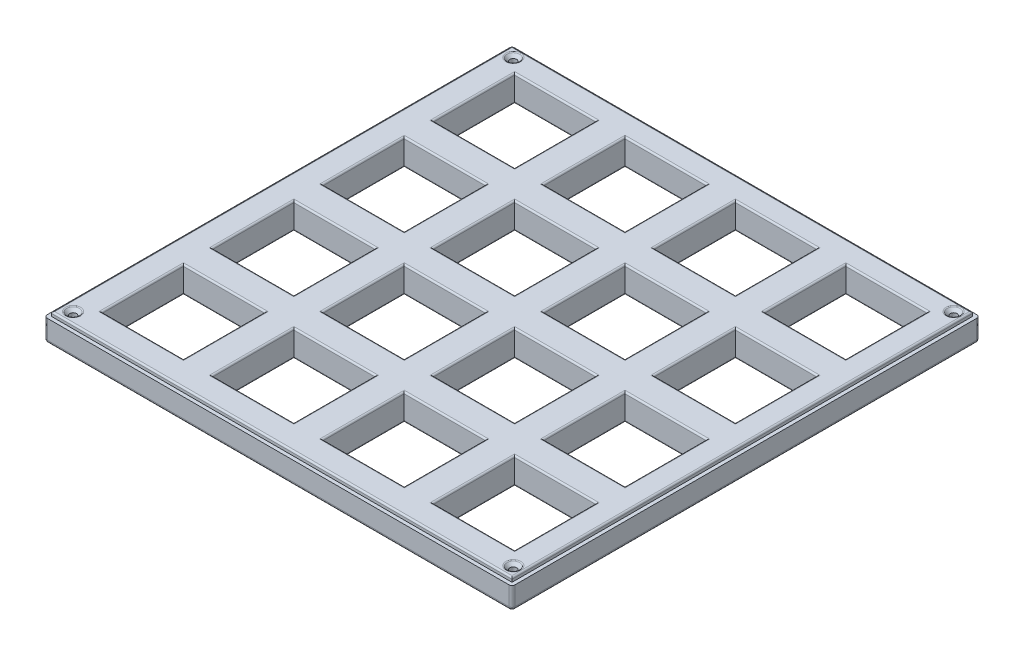
from build123d import *

# Parameters (mm, degrees)
SKETCH1_W           = 178
SKETCH1_H           = 178
BOSS_EXTRUDE1_DEPTH = 10
SKETCH2_W           = 31
SKETCH2_H           = 31
CUT_EXTRUDE1_DEPTH  = 10
SKETCH3_W           = 178
SKETCH3_H           = 178
SKETCH3_W_2         = 175.2
SKETCH3_H_2         = 175.2
CUT_EXTRUDE2_DEPTH  = 1.6
SKETCH4_R           = 1.3
CUT_EXTRUDE3_DEPTH  = 8
CHAMFER1_SIZE       = 1.3
FILLET1_R           = 0.6
FILLET2_R           = 1.2
FILLET3_R           = 0.6


with BuildPart() as part:
    # Sketch1 → Boss-Extrude1 (new body)
    with BuildSketch(Plane(origin=(0, 0, 0), x_dir=(1, 0, 0), z_dir=(0, 1, 0))):
        Rectangle(SKETCH1_W, SKETCH1_H)
    extrude(amount=BOSS_EXTRUDE1_DEPTH)

    # Sketch2 → Cut-Extrude1 (cut)
    with BuildSketch(Plane(origin=(0, 10, 0), x_dir=(1, 0, 0), z_dir=(0, 1, 0))):
        with Locations((21.5, 63.5)):
            Rectangle(SKETCH2_W, SKETCH2_H)
        with Locations((63.5, 63.5)):
            Rectangle(SKETCH2_W, SKETCH2_H)
        with Locations((-20.5, 63.5)):
            Rectangle(SKETCH2_W, SKETCH2_H)
        with Locations((-62.5, 63.5)):
            Rectangle(SKETCH2_W, SKETCH2_H)
        with Locations((21.5, 21.5)):
            Rectangle(SKETCH2_W, SKETCH2_H)
        with Locations((-20.5, 21.5)):
            Rectangle(SKETCH2_W, SKETCH2_H)
        with Locations((-62.5, 21.5)):
            Rectangle(SKETCH2_W, SKETCH2_H)
        with Locations((21.5, -20.5)):
            Rectangle(SKETCH2_W, SKETCH2_H)
        with Locations((-20.5, -20.5)):
            Rectangle(SKETCH2_W, SKETCH2_H)
        with Locations((-62.5, -20.5)):
            Rectangle(SKETCH2_W, SKETCH2_H)
        with Locations((21.5, -62.5)):
            Rectangle(SKETCH2_W, SKETCH2_H)
        with Locations((-20.5, -62.5)):
            Rectangle(SKETCH2_W, SKETCH2_H)
        with Locations((-62.5, -62.5)):
            Rectangle(SKETCH2_W, SKETCH2_H)
        with Locations((63.5, 21.5)):
            Rectangle(SKETCH2_W, SKETCH2_H)
        with Locations((63.5, -20.5)):
            Rectangle(SKETCH2_W, SKETCH2_H)
        with Locations((63.5, -62.5)):
            Rectangle(SKETCH2_W, SKETCH2_H)
    extrude(amount=-CUT_EXTRUDE1_DEPTH, mode=Mode.SUBTRACT)

    # Sketch3 → Cut-Extrude2 (cut)
    with BuildSketch(Plane(origin=(0, 10, 0), x_dir=(1, 0, 0), z_dir=(0, 1, 0))):
        Rectangle(SKETCH3_W, SKETCH3_H)
        Rectangle(SKETCH3_W_2, SKETCH3_H_2, mode=Mode.SUBTRACT)
    extrude(amount=-CUT_EXTRUDE2_DEPTH, mode=Mode.SUBTRACT)

    # Sketch4 → Cut-Extrude3 (cut)
    with BuildSketch(Plane(origin=(0, 10, 0), x_dir=(1, 0, 0), z_dir=(0, 1, 0))):
        with Locations(Location((84, 84, 0), (0, 0, 270))):
            Circle(SKETCH4_R)
        with Locations(Location((-83.5, 84, 0), (0, 0, 270))):
            Circle(SKETCH4_R)
        with Locations(Location((84, -83.5, 0), (0, 0, 270))):
            Circle(SKETCH4_R)
        with Locations(Location((-83.5, -83.5, 0), (0, 0, 270))):
            Circle(SKETCH4_R)
    extrude(amount=-CUT_EXTRUDE3_DEPTH, mode=Mode.SUBTRACT)

    # Chamfer1
    chamfer1_edges = [part.edges().sort_by_distance(p)[0] for p in [
        (-83.5, 10, -85.3),
        (84, 10, 82.2),
        (-83.5, 10, 82.2),
        (84, 10, -85.3),
    ]]
    chamfer(chamfer1_edges, length=CHAMFER1_SIZE)

    # Fillet1
    fillet1_edges = [part.edges().sort_by_distance(p)[0] for p in [
        (21.5, 10, -48),
        (37, 10, -63.5),
        (21.5, 10, -79),
        (6, 10, -63.5),
        (-20.5, 10, -48),
        (-5, 10, -63.5),
        (-20.5, 10, -79),
        (-36, 10, -63.5),
        (-62.5, 10, -48),
        (-47, 10, -63.5),
        (-62.5, 10, -79),
        (-78, 10, -63.5),
        (21.5, 10, -6),
        (37, 10, -21.5),
        (21.5, 10, -37),
        (6, 10, -21.5),
        (-62.5, 10, 78),
        (-47, 10, 62.5),
        (-62.5, 10, 47),
        (-78, 10, 62.5),
        (-20.5, 10, 78),
        (-5, 10, 62.5),
        (-20.5, 10, 47),
        (-36, 10, 62.5),
        (21.5, 10, 78),
        (37, 10, 62.5),
        (21.5, 10, 47),
        (6, 10, 62.5),
        (-62.5, 10, 36),
        (-47, 10, 20.5),
        (-62.5, 10, 5),
        (-78, 10, 20.5),
        (63.5, 10, -6),
        (79, 10, -21.5),
        (63.5, 10, -37),
        (48, 10, -21.5),
        (63.5, 10, 36),
        (79, 10, 20.5),
        (63.5, 10, 5),
        (48, 10, 20.5),
        (63.5, 10, 78),
        (79, 10, 62.5),
        (63.5, 10, 47),
        (48, 10, 62.5),
        (48, 10, -63.5),
        (63.5, 10, -48),
        (79, 10, -63.5),
        (63.5, 10, -79),
        (-87.6, 10, 0),
        (0, 10, -87.6),
        (87.6, 10, 0),
        (0, 10, 87.6),
        (-83.5, 10, 80.9),
        (-83.5, 10, -86.6),
        (84, 10, -86.6),
        (84, 10, 80.9),
        (-20.5, 10, 36),
        (-5, 10, 20.5),
        (-20.5, 10, 5),
        (-36, 10, 20.5),
        (21.5, 10, 36),
        (37, 10, 20.5),
        (21.5, 10, 5),
        (6, 10, 20.5),
        (-62.5, 10, -6),
        (-47, 10, -21.5),
        (-62.5, 10, -37),
        (-78, 10, -21.5),
        (-20.5, 10, -6),
        (-5, 10, -21.5),
        (-20.5, 10, -37),
        (-36, 10, -21.5),
    ]]
    fillet(fillet1_edges, radius=FILLET1_R)

    # Fillet2
    fillet2_edges = [part.edges().sort_by_distance(p)[0] for p in [
        (89, 4.2, -89),
        (89, 4.2, 89),
        (-89, 4.2, 89),
        (-89, 4.2, -89),
        (89, 0, 0),
        (0, 0, 89),
        (-89, 0, 0),
        (0, 0, -89),
    ]]
    fillet(fillet2_edges, radius=FILLET2_R)

    # Fillet3
    fillet3_edges = [part.edges().sort_by_distance(p)[0] for p in [
        (21.5, 0, -48),
        (6, 0, -63.5),
        (21.5, 0, -79),
        (37, 0, -63.5),
        (-20.5, 0, -48),
        (-36, 0, -63.5),
        (-20.5, 0, -79),
        (-5, 0, -63.5),
        (-62.5, 0, -48),
        (-78, 0, -63.5),
        (-62.5, 0, -79),
        (-47, 0, -63.5),
        (21.5, 0, -6),
        (6, 0, -21.5),
        (21.5, 0, -37),
        (37, 0, -21.5),
        (-62.5, 0, 78),
        (-78, 0, 62.5),
        (-62.5, 0, 47),
        (-47, 0, 62.5),
        (-20.5, 0, 78),
        (-36, 0, 62.5),
        (-20.5, 0, 47),
        (-5, 0, 62.5),
        (21.5, 0, 78),
        (6, 0, 62.5),
        (21.5, 0, 47),
        (37, 0, 62.5),
        (-62.5, 0, 36),
        (-78, 0, 20.5),
        (-62.5, 0, 5),
        (-47, 0, 20.5),
        (63.5, 0, -6),
        (48, 0, -21.5),
        (63.5, 0, -37),
        (79, 0, -21.5),
        (63.5, 0, 36),
        (48, 0, 20.5),
        (63.5, 0, 5),
        (79, 0, 20.5),
        (63.5, 0, 78),
        (48, 0, 62.5),
        (63.5, 0, 47),
        (79, 0, 62.5),
        (48, 0, -63.5),
        (63.5, 0, -79),
        (79, 0, -63.5),
        (63.5, 0, -48),
        (-20.5, 0, 36),
        (-36, 0, 20.5),
        (-20.5, 0, 5),
        (-5, 0, 20.5),
        (21.5, 0, 36),
        (6, 0, 20.5),
        (21.5, 0, 5),
        (37, 0, 20.5),
        (-62.5, 0, -6),
        (-78, 0, -21.5),
        (-62.5, 0, -37),
        (-47, 0, -21.5),
        (-20.5, 0, -6),
        (-36, 0, -21.5),
        (-20.5, 0, -37),
        (-5, 0, -21.5),
    ]]
    fillet(fillet3_edges, radius=FILLET3_R)


solid = part.part
